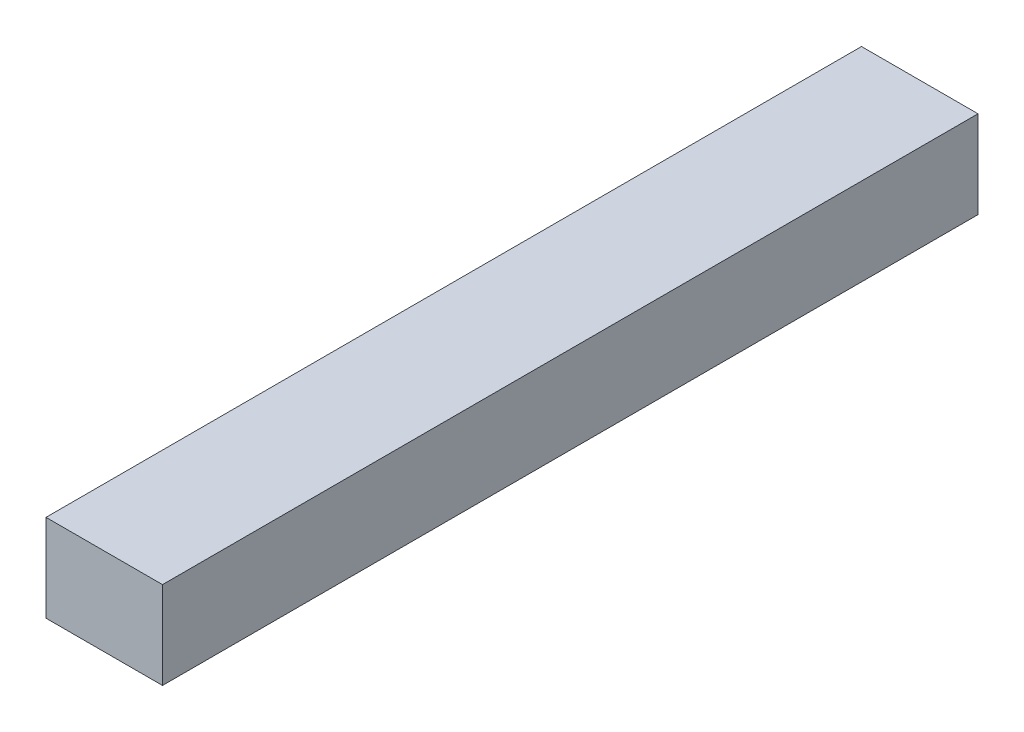
from build123d import *

# Parameters (mm, degrees)
SKETCH2_W           = 177.8
SKETCH2_H           = 19.05
BOSS_EXTRUDE1_DEPTH = 25.4


with BuildPart() as part:
    # Sketch2 → Boss-Extrude1 (new body)
    with BuildSketch(Plane(origin=(0, 0, 0), x_dir=(0, 0, -1), z_dir=(1, 0, 0))):
        with Locations((88.9, 9.525)):
            Rectangle(SKETCH2_W, SKETCH2_H)
    extrude(amount=BOSS_EXTRUDE1_DEPTH)


solid = part.part
